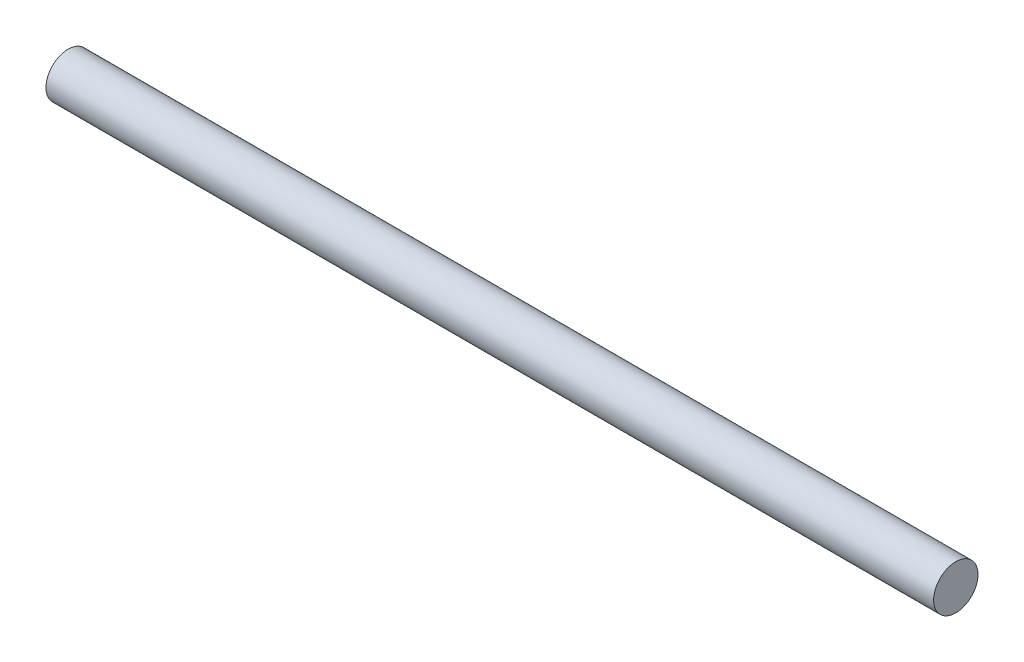
from build123d import *

# Parameters (mm, degrees)
SKETCH1_R           = 3.175
BOSS_EXTRUDE1_DEPTH = 63.5


with BuildPart() as part:
    # Sketch1 → Boss-Extrude1 (new, symmetric)
    with BuildSketch(Plane(origin=(0, 0, 0), x_dir=(0, 0, -1), z_dir=(1, 0, 0))):
        Circle(SKETCH1_R)
    extrude(amount=BOSS_EXTRUDE1_DEPTH, both=True)


solid = part.part
